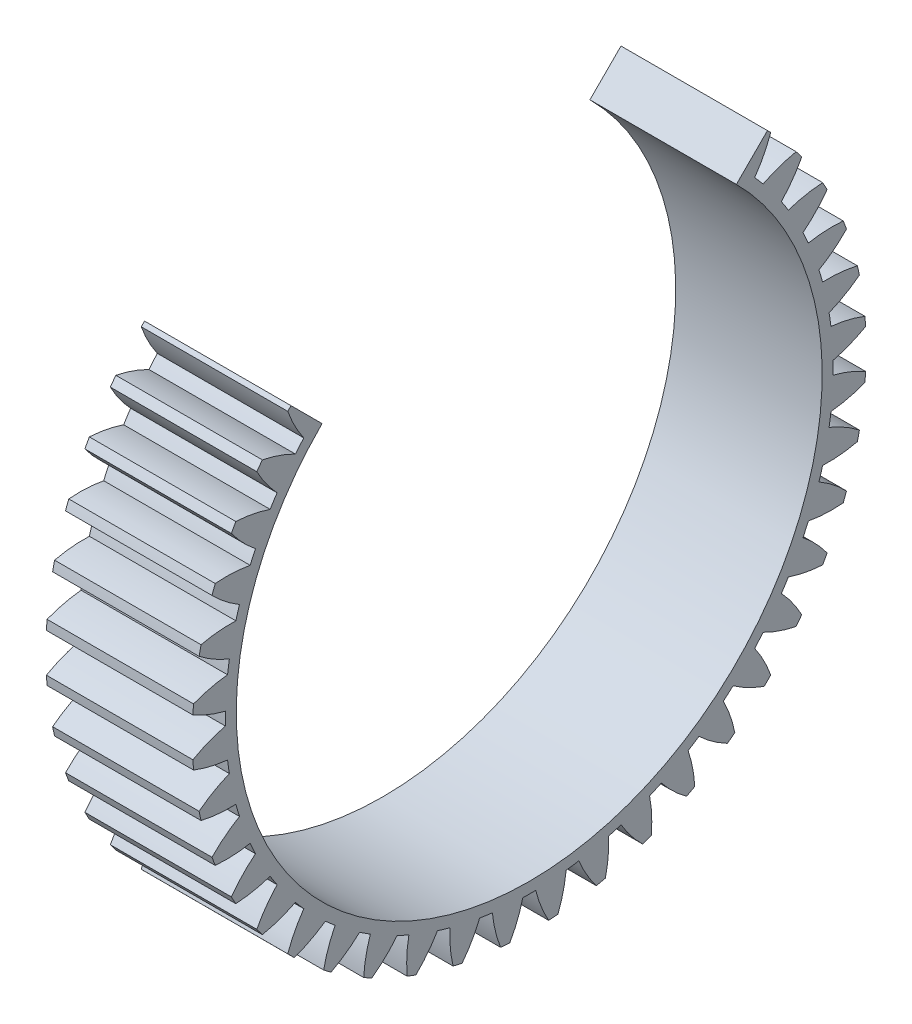
from build123d import *

# Parameters (mm, degrees)
BASPROSKE_W        = 15
BASPROSKE_H        = 34.5
TOOTHCUT_DEPTH     = 52.044098581
TEETHCUTS_COUNT    = 44
TEETHCUTS_ANGLE    = 351.818181818
BORSKE_R           = 30
BORE_DEPTH         = 50.0000508
CUT_EXTRUDE1_DEPTH = 51.966732888


with BuildPart() as part:
    # BasProSke → Base-Revolve (revolve)
    with BuildSketch(Plane(origin=(0, 0, 0), x_dir=(1, 0, 0), z_dir=(0, 1, 0)), mode=Mode.PRIVATE) as base_revolve_sk:
        with Locations((7.5, 17.25)):
            Rectangle(BASPROSKE_W, BASPROSKE_H)
    revolve(base_revolve_sk.sketch.rotate(Axis((-10, 0, 0), (1, 0, 0)), 180), axis=Axis((-10, 0, 0), (1, 0, 0)))

    # TooCutSke → ToothCut (cut, through all)
    with BuildSketch(Plane(origin=(0, 0, 0), x_dir=(0, 0, -1), z_dir=(1, 0, 0))):
        with BuildLine():
            ThreePointArc((0.659078276, 31.117020934), (0, 31.124), (-0.659078276, 31.117020934))
            ThreePointArc((-0.659078276, 31.117020934), (-1.214735342, 32.838267173), (-2.000473431, 34.467395481))
            ThreePointArc((-2.000473431, 34.467395481), (0, 34.5254), (2.000473431, 34.467395481))
            ThreePointArc((2.000473431, 34.467395481), (1.214735342, 32.838267173), (0.659078276, 31.117020934))
        make_face()
    toothcut = extrude(amount=TOOTHCUT_DEPTH, mode=Mode.SUBTRACT)

    # TeethCuts: ToothCut ×44 about axis
    teethcuts_axis = Axis((-10, 0, 0), (1, 0, 0))
    for i in range(1, TEETHCUTS_COUNT):
        add(toothcut.rotate(teethcuts_axis, i * TEETHCUTS_ANGLE / (TEETHCUTS_COUNT - 1)), mode=Mode.SUBTRACT)

    # BorSke → Bore (cut, symmetric)
    with BuildSketch(Plane(origin=(0, 0, 0), x_dir=(0, 0, -1), z_dir=(1, 0, 0))):
        with Locations(Location((0, 0, 0), (0, 0, 180))):
            Circle(BORSKE_R)
    extrude(amount=BORE_DEPTH, both=True, mode=Mode.SUBTRACT)

    # Sketch1 → Cut-Extrude1 (cut, through all)
    with BuildSketch(Plane(origin=(15, 0, 0), x_dir=(0, 0, -1), z_dir=(1, 0, 0))):
        with BuildLine():
            Line((-24.395183951, 24.395183951), (-21.213203436, 21.213203436))
            ThreePointArc((-21.213203436, 21.213203436), (0, 30), (21.213203436, 21.213203436))
            Line((21.213203436, 21.213203436), (24.395183951, 24.395183951))
            ThreePointArc((24.395183951, 24.395183951), (0, 34.5), (-24.395183951, 24.395183951))
        make_face()
    extrude(amount=-CUT_EXTRUDE1_DEPTH, mode=Mode.SUBTRACT)


solid = part.part
